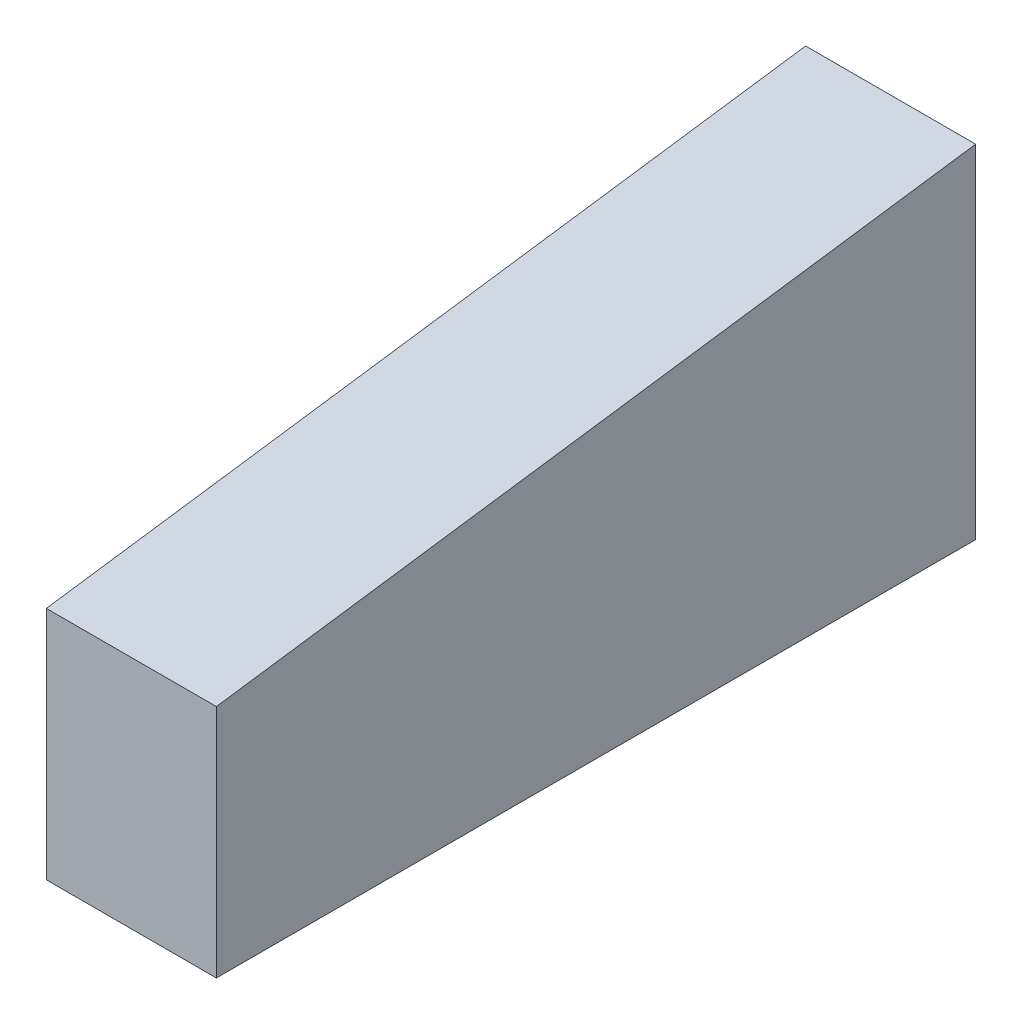
from build123d import *

# Parameters (mm, degrees)
SKETCH1_W           = 49.64941617
SKETCH1_H           = 221.697132798
BOSS_EXTRUDE1_DEPTH = 100
CUT_EXTRUDE1_DEPTH  = 100


with BuildPart() as part:
    # Sketch1 → Boss-Extrude1 (new body)
    with BuildSketch(Plane(origin=(0, 0, 0), x_dir=(1, 0, 0), z_dir=(0, 1, 0))):
        Rectangle(SKETCH1_W, SKETCH1_H)
    extrude(amount=BOSS_EXTRUDE1_DEPTH)

    # Sketch2 → Cut-Extrude1 (cut)
    with BuildSketch(Plane(origin=(24.824708085, 0, 0), x_dir=(0, 0, -1), z_dir=(1, 0, 0))):
        Polygon((110.848566399, 100), (-110.848566399, 68.633623225), (-110.848566399, 100), align=None)
    extrude(amount=-CUT_EXTRUDE1_DEPTH, mode=Mode.SUBTRACT)


solid = part.part
